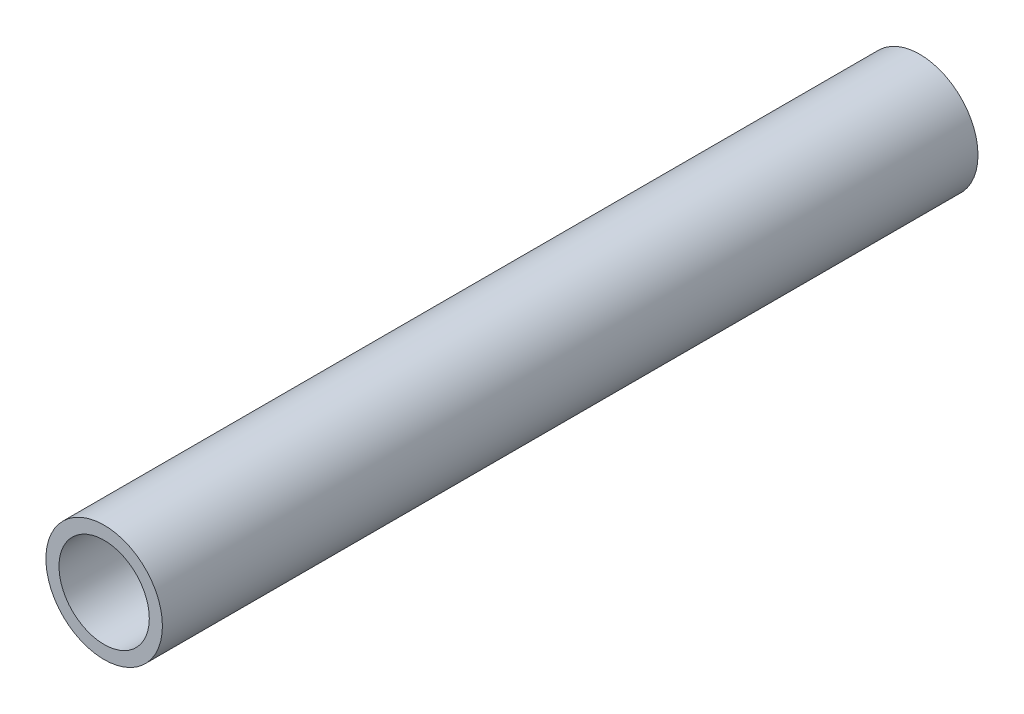
from build123d import *

# Parameters (mm, degrees)
SKETCH_1_R      = 1
SKETCH_1_R_2    = 0.775
EXTRUDE_1_DEPTH = 14


with BuildPart() as part:
    # Эскиз1 → Бобышка-Вытянуть1 (new body)
    with BuildSketch(Plane.XY):
        Circle(SKETCH_1_R)
        Circle(SKETCH_1_R_2, mode=Mode.SUBTRACT)
    extrude(amount=EXTRUDE_1_DEPTH)


solid = part.part
